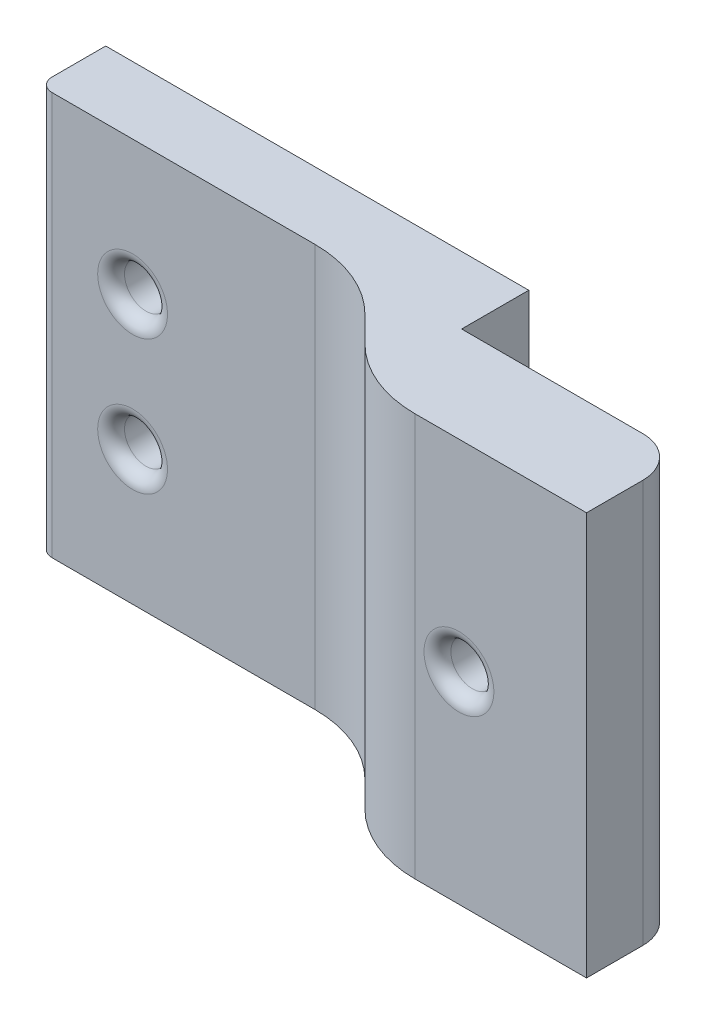
from build123d import *

# Parameters (mm, degrees)
BOSS_EXTRUDE1_DEPTH = 30
SKETCH2_R           = 1.6
CUT_EXTRUDE1_DEPTH  = 7.2
SKETCH3_R           = 1.6
CUT_EXTRUDE2_DEPTH  = 5
FILLET1_R           = 1
FILLET2_R           = 3
FILLET3_R           = 9
FILLET4_R           = 1


with BuildPart() as part:
    # Sketch1 → Boss-Extrude1 (new body)
    with BuildSketch(Plane(origin=(0, 0, 0), x_dir=(1, 0, 0), z_dir=(0, 1, 0))):
        Polygon((-5.878996076, -9.092386916), (-13.078996076, -1.892386916), (-37.378996076, -1.892386916), (-37.378996076, 3.107613084), (-5.878996076, 3.107613084), (-5.878996076, -1.892386916), (10.621003924, -1.892386916), (10.621003924, -9.092386916), align=None)
    extrude(amount=BOSS_EXTRUDE1_DEPTH)

    # Sketch2 → Cut-Extrude1 (cut)
    with BuildSketch(Plane.XY.offset(9.092386916)):
        with Locations((1.121003924, 15)):
            Circle(SKETCH2_R)
    extrude(amount=-CUT_EXTRUDE1_DEPTH, mode=Mode.SUBTRACT)

    # Sketch3 → Cut-Extrude2 (cut)
    with BuildSketch(Plane.XY.offset(1.892386916)):
        with Locations((-30.378996076, 20)):
            Circle(SKETCH3_R)
        with Locations((-30.378996076, 10)):
            Circle(SKETCH3_R)
    extrude(amount=-CUT_EXTRUDE2_DEPTH, mode=Mode.SUBTRACT)

    # Fillet1
    fillet1_edges = [part.edges().sort_by_distance(p)[0] for p in [
        (-0.478996076, 15, 9.092386916),
        (-0.478996076, 15, 1.892386916),
        (-31.978996076, 20, 1.892386916),
        (-31.978996076, 20, -3.107613084),
        (-31.978996076, 10, 1.892386916),
        (-31.978996076, 10, -3.107613084),
    ]]
    fillet(fillet1_edges, radius=FILLET1_R)

    # Fillet2
    fillet2_edges = [part.edges().sort_by_distance(p)[0] for p in [
        (10.621003924, 15, 1.892386916),
    ]]
    fillet(fillet2_edges, radius=FILLET2_R)

    # Fillet3
    fillet3_edges = [part.edges().sort_by_distance(p)[0] for p in [
        (-5.878996076, 15, 9.092386916),
        (-13.078996076, 15, 1.892386916),
    ]]
    fillet(fillet3_edges, radius=FILLET3_R)

    # Fillet4
    fillet4_edges = [part.edges().sort_by_distance(p)[0] for p in [
        (-37.378996076, 15, 1.892386916),
    ]]
    fillet(fillet4_edges, radius=FILLET4_R)


solid = part.part
